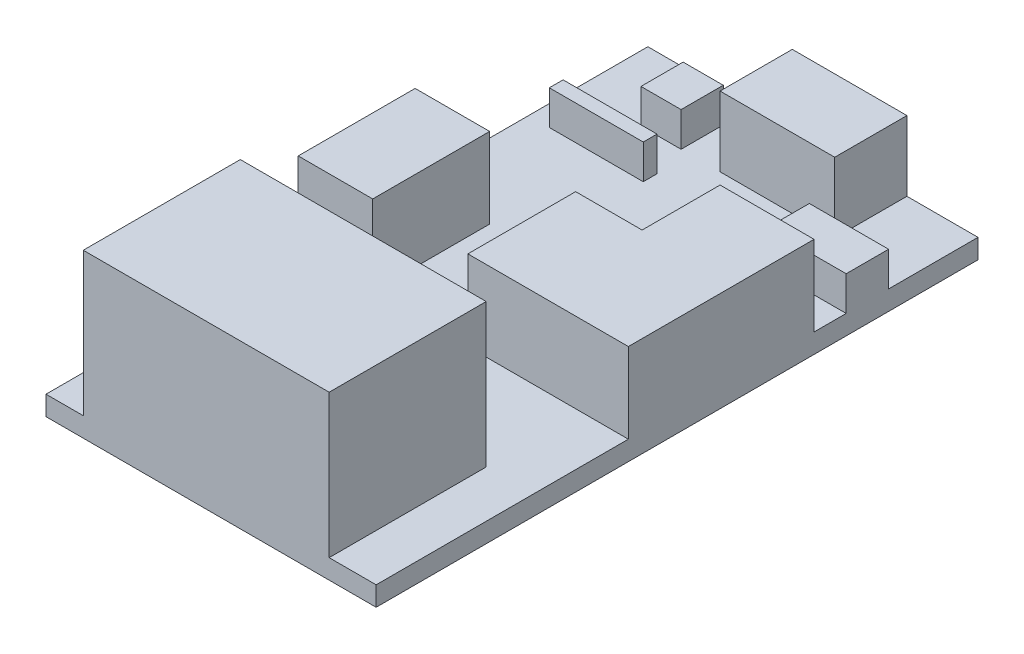
from build123d import *

# Parameters (mm, degrees)
SZKIC1_W                    = 28.8
SZKIC1_H                    = 52.5
DODANIE_WYCI_GNI_CIE1_DEPTH = 1.7
SZKIC2_W                    = 21.45
SZKIC2_H                    = 13.7
DODANIE_WYCI_GNI_CIE2_DEPTH = 12.5
SZKIC3_W                    = 10
SZKIC3_H                    = 6.3
DODANIE_WYCI_GNI_CIE3_DEPTH = 6.1
SZKIC4_W                    = 6.912979227
SZKIC4_H                    = 3.7
DODANIE_WYCI_GNI_CIE4_DEPTH = 3
SZKIC5_R                    = 1.451396222
SZKIC5_R_2                  = 1.016690736
SZKIC5_R_3                  = 1.990845458
SZKIC5_R_4                  = 0.709805555
DODANIE_WYCI_GNI_CIE5_DEPTH = 2.5
SZKIC6_W                    = 3.5
SZKIC6_H                    = 3.678360942
DODANIE_WYCI_GNI_CIE6_DEPTH = 3
SZKIC7_W                    = 8.193889987
SZKIC7_H                    = 1.2
DODANIE_WYCI_GNI_CIE7_DEPTH = 3
SZKIC8_W                    = 6.5
SZKIC8_H                    = 10.2
DODANIE_WYCI_GNI_CIE8_DEPTH = 7


with BuildPart() as part:
    # Szkic1 → Dodanie-wyciągnięcie1 (new body)
    with BuildSketch(Plane(origin=(0, 0, 0), x_dir=(1, 0, 0), z_dir=(0, 1, 0))):
        with Locations((-4.171428571, -3.78968254)):
            Rectangle(SZKIC1_W, SZKIC1_H)
    extrude(amount=DODANIE_WYCI_GNI_CIE1_DEPTH)

    # Szkic2 → Dodanie-wyciągnięcie2 (add)
    with BuildSketch(Plane(origin=(0, 1.7, 0), x_dir=(1, 0, 0), z_dir=(0, 1, 0))):
        with Locations((-4.596428571, -23.18968254)):
            Rectangle(SZKIC2_W, SZKIC2_H)
    extrude(amount=DODANIE_WYCI_GNI_CIE2_DEPTH)

    # Szkic3 → Dodanie-wyciągnięcie3 (add)
    with BuildSketch(Plane(origin=(0, 1.7, 0), x_dir=(1, 0, 0), z_dir=(0, 1, 0))):
        with Locations((-0.971428571, 19.31031746)):
            Rectangle(SZKIC3_W, SZKIC3_H)
    extrude(amount=DODANIE_WYCI_GNI_CIE3_DEPTH)

    # Szkic4 → Dodanie-wyciągnięcie4 (add)
    with BuildSketch(Plane(origin=(0, 1.7, 0), x_dir=(1, 0, 0), z_dir=(0, 1, 0))):
        with Locations((6.772081815, 12.81031746)):
            Rectangle(SZKIC4_W, SZKIC4_H)
    extrude(amount=DODANIE_WYCI_GNI_CIE4_DEPTH)

    # Szkic5 → Dodanie-wyciągnięcie5 (add)
    with BuildSketch(Plane.XZ):
        with Locations(Location((-5.427705737, 24.874487644, 0), (0, 0, 90))):
            Circle(SZKIC5_R)
        with Locations(Location((0, 21.386133845, 0), (0, 0, 90))):
            Circle(SZKIC5_R_2)
        with Locations(Location((-6.879101959, -3.162519717, 0), (0, 0, 90))):
            Circle(SZKIC5_R_3)
        with Locations(Location((-1.016690736, -10.689240837, 0), (0, 0, 90))):
            Circle(SZKIC5_R_4)
    extrude(amount=DODANIE_WYCI_GNI_CIE5_DEPTH)

    # Szkic6 → Dodanie-wyciągnięcie6 (add)
    with BuildSketch(Plane(origin=(0, 1.7, 0), x_dir=(1, 0, 0), z_dir=(0, 1, 0))):
        with Locations((-11.121428571, 17.999497931)):
            Rectangle(SZKIC6_W, SZKIC6_H)
    extrude(amount=DODANIE_WYCI_GNI_CIE6_DEPTH)

    # Szkic7 → Dodanie-wyciągnięcie7 (add)
    with BuildSketch(Plane(origin=(0, 1.7, 0), x_dir=(1, 0, 0), z_dir=(0, 1, 0))):
        with Locations((-12.668373565, 12.66031746)):
            Rectangle(SZKIC7_W, SZKIC7_H)
    extrude(amount=DODANIE_WYCI_GNI_CIE7_DEPTH)

    # Szkic8 → Dodanie-wyciągnięcie8 (add)
    with BuildSketch(Plane(origin=(0, 1.7, 0), x_dir=(1, 0, 0), z_dir=(0, 1, 0))):
        with Locations((-15.321428571, -2.93968254)):
            Rectangle(SZKIC8_W, SZKIC8_H)
        Polygon((10.228571429, -8.03968254), (-3.771428571, -8.03968254), (-3.771428571, 1.36031746), (2.028571429, 1.36031746), (2.028571429, 8.16031746), (10.228571429, 8.16031746), align=None)
    extrude(amount=DODANIE_WYCI_GNI_CIE8_DEPTH)


solid = part.part
